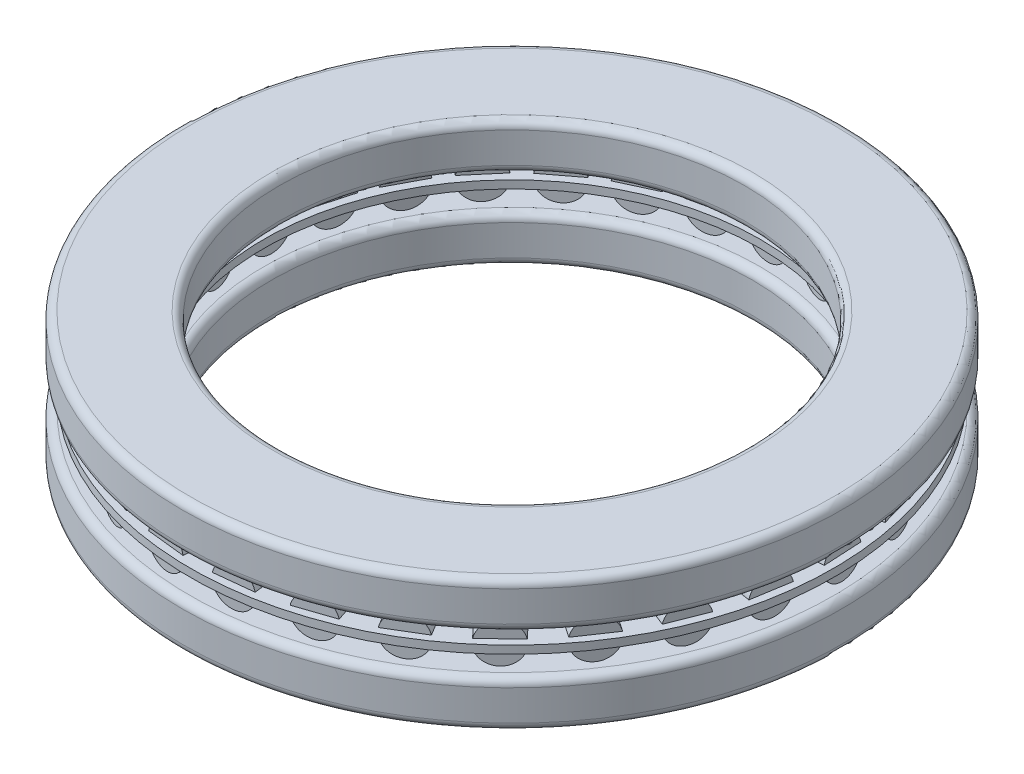
from build123d import *

# Parameters (mm, degrees)
SKETCH_7_W               = 9.5
SKETCH_7_H               = 1.02
SKETCH_4_3_W             = 2.55
SKETCH_4_3_H             = 7.5
PATTERN_CIRCULAR_2_COUNT = 29
SKETCH_4_W               = 2.55
SKETCH_4_H               = 7.5
PATTERN_CIRCULAR_1_COUNT = 29


with BuildPart() as part:
    # 草图2 → 旋转1 (revolve)
    with BuildSketch(Plane(origin=(0, 0, 0), x_dir=(0, 0, -1), z_dir=(1, 0, 0))):
        with BuildLine():
            Line((32, 2.975), (41.5, 2.975))
            ThreePointArc((41.5, 2.975), (42.207106781, 2.682106781), (42.5, 1.975))
            Line((42.5, 1.975), (42.5, -1.975))
            ThreePointArc((42.5, -1.975), (42.207106781, -2.682106781), (41.5, -2.975))
            Line((41.5, -2.975), (32, -2.975))
            ThreePointArc((32, -2.975), (31.292893219, -2.682106781), (31, -1.975))
            Line((31, -1.975), (31, 1.975))
            ThreePointArc((31, 1.975), (31.292893219, 2.682106781), (32, 2.975))
        make_face()
    revolve(axis=Axis((0, 0, 0), (0, 1, 0)))


with BuildPart() as body_2:
    # 草图3 → 旋转2 (revolve)
    with BuildSketch(Plane(origin=(0, 0, 0), x_dir=(0, 0, -1), z_dir=(1, 0, 0))):
        with BuildLine():
            Line((31, 14.025), (41.5, 14.025))
            ThreePointArc((41.5, 14.025), (42.207106781, 13.732106781), (42.5, 13.025))
            Line((42.5, 13.025), (42.5, 9.075))
            ThreePointArc((42.5, 9.075), (42.207106781, 8.367893219), (41.5, 8.075))
            Line((41.5, 8.075), (31, 8.075))
            ThreePointArc((31, 8.075), (30.292893219, 8.367893219), (30, 9.075))
            Line((30, 9.075), (30, 13.025))
            ThreePointArc((30, 13.025), (30.292893219, 13.732106781), (31, 14.025))
        make_face()
    revolve(axis=Axis((0, 0, 0), (0, 1, 0)))


with BuildPart() as body_3:
    # 草图7 → 旋转4 (revolve)
    with BuildSketch(Plane(origin=(0, 0, 0), x_dir=(0, 0, -1), z_dir=(1, 0, 0))):
        with Locations((36.75, 5.525)):
            Rectangle(SKETCH_7_W, SKETCH_7_H)
    revolve(axis=Axis((0, 0, 0), (0, 1, 0)))

    # 草图4<3> → 切除-旋转1 (revolve, cut)
    with BuildSketch(Plane.XZ.offset(-5.525)):
        with Locations((-1.275, -36.75)):
            Rectangle(SKETCH_4_3_W, SKETCH_4_3_H)
    cut_revolve_1 = revolve(axis=Axis((0, 5.525, 0), (0, 0, -1)), mode=Mode.SUBTRACT)

    # 阵列(圆周)2: 切除-旋转1 ×29 about axis
    pattern_circular_2_axis = Axis((0, 0, 0), (0, -1, 0))
    for i in range(1, PATTERN_CIRCULAR_2_COUNT):
        add(cut_revolve_1.rotate(pattern_circular_2_axis, i * 360 / PATTERN_CIRCULAR_2_COUNT), mode=Mode.SUBTRACT)


with BuildPart() as body_4:
    # 草图4 → 旋转3 (revolve)
    with BuildSketch(Plane.XZ.offset(-5.525)):
        with Locations((-1.275, -36.75)):
            Rectangle(SKETCH_4_W, SKETCH_4_H)
    revolve(axis=Axis((0, 5.525, 0), (0, 0, -1)))


with BuildPart() as pattern_circular_1_1:
    # 阵列(圆周)1: pattern copy
    add(body_4.part.rotate(Axis((0, 0, 0), (0, -1, 0)), 1 * 360 / PATTERN_CIRCULAR_1_COUNT))


with BuildPart() as pattern_circular_1_2:
    # 阵列(圆周)1: pattern copy
    add(body_4.part.rotate(Axis((0, 0, 0), (0, -1, 0)), 2 * 360 / PATTERN_CIRCULAR_1_COUNT))


with BuildPart() as pattern_circular_1_3:
    # 阵列(圆周)1: pattern copy
    add(body_4.part.rotate(Axis((0, 0, 0), (0, -1, 0)), 3 * 360 / PATTERN_CIRCULAR_1_COUNT))


with BuildPart() as pattern_circular_1_4:
    # 阵列(圆周)1: pattern copy
    add(body_4.part.rotate(Axis((0, 0, 0), (0, -1, 0)), 4 * 360 / PATTERN_CIRCULAR_1_COUNT))


with BuildPart() as pattern_circular_1_5:
    # 阵列(圆周)1: pattern copy
    add(body_4.part.rotate(Axis((0, 0, 0), (0, -1, 0)), 5 * 360 / PATTERN_CIRCULAR_1_COUNT))


with BuildPart() as pattern_circular_1_6:
    # 阵列(圆周)1: pattern copy
    add(body_4.part.rotate(Axis((0, 0, 0), (0, -1, 0)), 6 * 360 / PATTERN_CIRCULAR_1_COUNT))


with BuildPart() as pattern_circular_1_7:
    # 阵列(圆周)1: pattern copy
    add(body_4.part.rotate(Axis((0, 0, 0), (0, -1, 0)), 7 * 360 / PATTERN_CIRCULAR_1_COUNT))


with BuildPart() as pattern_circular_1_8:
    # 阵列(圆周)1: pattern copy
    add(body_4.part.rotate(Axis((0, 0, 0), (0, -1, 0)), 8 * 360 / PATTERN_CIRCULAR_1_COUNT))


with BuildPart() as pattern_circular_1_9:
    # 阵列(圆周)1: pattern copy
    add(body_4.part.rotate(Axis((0, 0, 0), (0, -1, 0)), 9 * 360 / PATTERN_CIRCULAR_1_COUNT))


with BuildPart() as pattern_circular_1_10:
    # 阵列(圆周)1: pattern copy
    add(body_4.part.rotate(Axis((0, 0, 0), (0, -1, 0)), 10 * 360 / PATTERN_CIRCULAR_1_COUNT))


with BuildPart() as pattern_circular_1_11:
    # 阵列(圆周)1: pattern copy
    add(body_4.part.rotate(Axis((0, 0, 0), (0, -1, 0)), 11 * 360 / PATTERN_CIRCULAR_1_COUNT))


with BuildPart() as pattern_circular_1_12:
    # 阵列(圆周)1: pattern copy
    add(body_4.part.rotate(Axis((0, 0, 0), (0, -1, 0)), 12 * 360 / PATTERN_CIRCULAR_1_COUNT))


with BuildPart() as pattern_circular_1_13:
    # 阵列(圆周)1: pattern copy
    add(body_4.part.rotate(Axis((0, 0, 0), (0, -1, 0)), 13 * 360 / PATTERN_CIRCULAR_1_COUNT))


with BuildPart() as pattern_circular_1_14:
    # 阵列(圆周)1: pattern copy
    add(body_4.part.rotate(Axis((0, 0, 0), (0, -1, 0)), 14 * 360 / PATTERN_CIRCULAR_1_COUNT))


with BuildPart() as pattern_circular_1_15:
    # 阵列(圆周)1: pattern copy
    add(body_4.part.rotate(Axis((0, 0, 0), (0, -1, 0)), 15 * 360 / PATTERN_CIRCULAR_1_COUNT))


with BuildPart() as pattern_circular_1_16:
    # 阵列(圆周)1: pattern copy
    add(body_4.part.rotate(Axis((0, 0, 0), (0, -1, 0)), 16 * 360 / PATTERN_CIRCULAR_1_COUNT))


with BuildPart() as pattern_circular_1_17:
    # 阵列(圆周)1: pattern copy
    add(body_4.part.rotate(Axis((0, 0, 0), (0, -1, 0)), 17 * 360 / PATTERN_CIRCULAR_1_COUNT))


with BuildPart() as pattern_circular_1_18:
    # 阵列(圆周)1: pattern copy
    add(body_4.part.rotate(Axis((0, 0, 0), (0, -1, 0)), 18 * 360 / PATTERN_CIRCULAR_1_COUNT))


with BuildPart() as pattern_circular_1_19:
    # 阵列(圆周)1: pattern copy
    add(body_4.part.rotate(Axis((0, 0, 0), (0, -1, 0)), 19 * 360 / PATTERN_CIRCULAR_1_COUNT))


with BuildPart() as pattern_circular_1_20:
    # 阵列(圆周)1: pattern copy
    add(body_4.part.rotate(Axis((0, 0, 0), (0, -1, 0)), 20 * 360 / PATTERN_CIRCULAR_1_COUNT))


with BuildPart() as pattern_circular_1_21:
    # 阵列(圆周)1: pattern copy
    add(body_4.part.rotate(Axis((0, 0, 0), (0, -1, 0)), 21 * 360 / PATTERN_CIRCULAR_1_COUNT))


with BuildPart() as pattern_circular_1_22:
    # 阵列(圆周)1: pattern copy
    add(body_4.part.rotate(Axis((0, 0, 0), (0, -1, 0)), 22 * 360 / PATTERN_CIRCULAR_1_COUNT))


with BuildPart() as pattern_circular_1_23:
    # 阵列(圆周)1: pattern copy
    add(body_4.part.rotate(Axis((0, 0, 0), (0, -1, 0)), 23 * 360 / PATTERN_CIRCULAR_1_COUNT))


with BuildPart() as pattern_circular_1_24:
    # 阵列(圆周)1: pattern copy
    add(body_4.part.rotate(Axis((0, 0, 0), (0, -1, 0)), 24 * 360 / PATTERN_CIRCULAR_1_COUNT))


with BuildPart() as pattern_circular_1_25:
    # 阵列(圆周)1: pattern copy
    add(body_4.part.rotate(Axis((0, 0, 0), (0, -1, 0)), 25 * 360 / PATTERN_CIRCULAR_1_COUNT))


with BuildPart() as pattern_circular_1_26:
    # 阵列(圆周)1: pattern copy
    add(body_4.part.rotate(Axis((0, 0, 0), (0, -1, 0)), 26 * 360 / PATTERN_CIRCULAR_1_COUNT))


with BuildPart() as pattern_circular_1_27:
    # 阵列(圆周)1: pattern copy
    add(body_4.part.rotate(Axis((0, 0, 0), (0, -1, 0)), 27 * 360 / PATTERN_CIRCULAR_1_COUNT))


with BuildPart() as pattern_circular_1_28:
    # 阵列(圆周)1: pattern copy
    add(body_4.part.rotate(Axis((0, 0, 0), (0, -1, 0)), 28 * 360 / PATTERN_CIRCULAR_1_COUNT))


solid = Compound([part.part, body_2.part, body_3.part, body_4.part, pattern_circular_1_1.part, pattern_circular_1_2.part, pattern_circular_1_3.part, pattern_circular_1_4.part, pattern_circular_1_5.part, pattern_circular_1_6.part, pattern_circular_1_7.part, pattern_circular_1_8.part, pattern_circular_1_9.part, pattern_circular_1_10.part, pattern_circular_1_11.part, pattern_circular_1_12.part, pattern_circular_1_13.part, pattern_circular_1_14.part, pattern_circular_1_15.part, pattern_circular_1_16.part, pattern_circular_1_17.part, pattern_circular_1_18.part, pattern_circular_1_19.part, pattern_circular_1_20.part, pattern_circular_1_21.part, pattern_circular_1_22.part, pattern_circular_1_23.part, pattern_circular_1_24.part, pattern_circular_1_25.part, pattern_circular_1_26.part, pattern_circular_1_27.part, pattern_circular_1_28.part])
